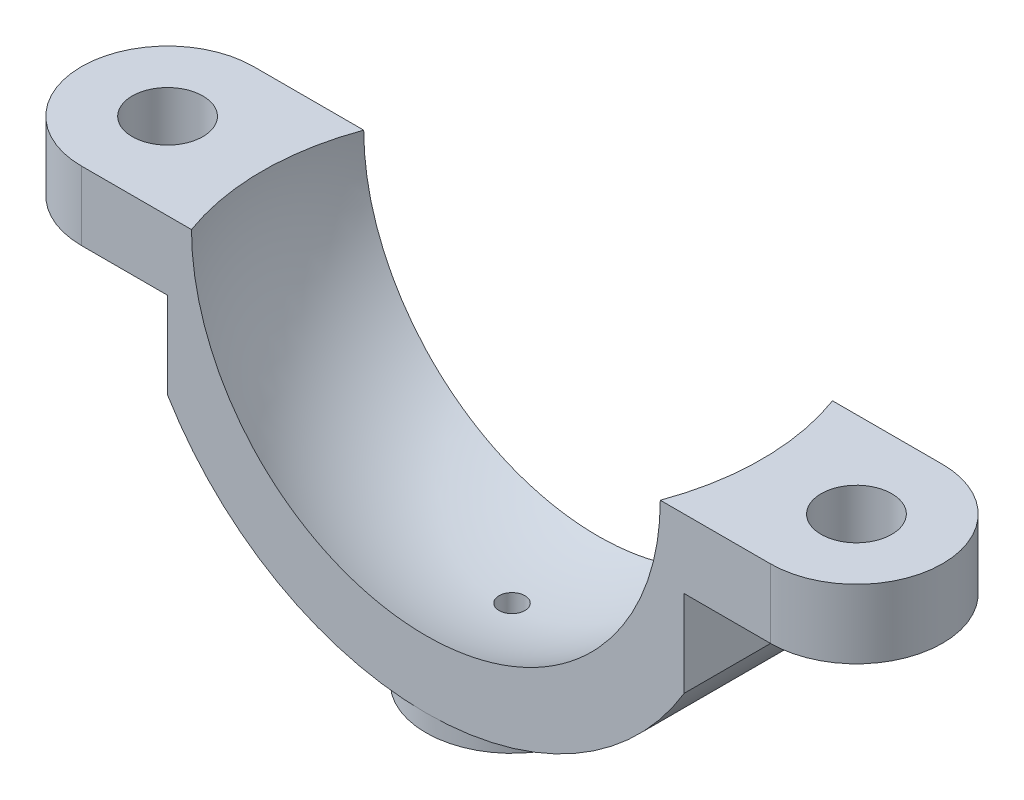
from build123d import *

# Parameters (mm, degrees)
EXTRUDE_2_DEPTH      = 19
EXTRUDE_3_DEPTH      = 40
CUT_EXTRUDE_START    = -32
CUT_EXTRUDE_1_DEPTH  = 32
SKETCH_4_R           = 4.1
CUT_EXTRUDE_2_DEPTH  = 60.916608716
EXTRUDE_4_REACH      = 102.922
EXTRUDE_4_END_RADIUS = 35
EXTRUDE_START        = -37
SKETCH_5_R           = 10
SKETCH_5_R_2         = 1.5
SKETCH_5_4_R         = 1.5
CUT_EXTRUDE_3_DEPTH  = 66.038450252
CUT_EXTRUDE_4_DEPTH  = 12
SKETCH_6_R           = 4
CUT_EXTRUDE_5_DEPTH  = 30
SKETCH_10_W          = 80
SKETCH_10_H          = 68
CUT_EXTRUDE_6_DEPTH  = 76.617458351
SKETCH_11_W          = 80
SKETCH_11_H          = 20
CUT_EXTRUDE_7_DEPTH  = 69.629439801
SKETCH_12_W          = 10
SKETCH_12_H          = 20
CUT_EXTRUDE_8_DEPTH  = 59.660037571
SKETCH_13_W          = 10
SKETCH_13_H          = 20
CUT_EXTRUDE_9_DEPTH  = 59.660037571
SKETCH_14_R          = 1.5
CUT_EXTRUDE_10_DEPTH = 64.000000016


with BuildPart() as part:
    # Эскиз1 → Бобышка-Вытянуть2 (new, symmetric)
    with BuildSketch(Plane.XY):
        with BuildLine():
            Line((35, 0), (26, 0))
            ThreePointArc((26, 0), (0, -26), (-26, 0))
            Line((-26, 0), (-35, 0))
            ThreePointArc((-35, 0), (0, -35), (35, 0))
        make_face()
        with BuildLine():
            Line((26, 0), (24, 0))
            ThreePointArc((24, 0), (0, -24), (-24, 0))
            Line((-24, 0), (-26, 0))
            ThreePointArc((-26, 0), (0, -26), (26, 0))
        make_face()
    extrude(amount=EXTRUDE_2_DEPTH, both=True)

    # Эскиз2 → Бобышка-Вытянуть3 (add)
    with BuildSketch(Plane(origin=(0, 0, 0), x_dir=(1, 0, 0), z_dir=(0, 1, 0))):
        with BuildLine():
            ThreePointArc((50, 0), (47.071067812, 7.071067812), (40, 10))
            ThreePointArc((40, 10), (37.411809549, 9.659258263), (35, 8.660254038))
            Line((35, 8.660254038), (35, -8.660254038))
            ThreePointArc((35, -8.660254038), (37.411809549, -9.659258263), (40, -10))
            ThreePointArc((40, -10), (47.071067812, -7.071067812), (50, 0))
        make_face()
        with BuildLine():
            Line((35, -8.660254038), (35, 8.660254038))
            ThreePointArc((35, 8.660254038), (31.339745962, 5), (30, 0))
            ThreePointArc((30, 0), (31.339745962, -5), (35, -8.660254038))
        make_face()
        with BuildLine():
            ThreePointArc((35, 8.660254038), (37.411809549, 9.659258263), (40, 10))
            Line((40, 10), (35, 10))
            Line((35, 10), (35, 8.660254038))
        make_face()
        with BuildLine():
            Line((35, -10), (40, -10))
            ThreePointArc((40, -10), (37.411809549, -9.659258263), (35, -8.660254038))
            Line((35, -8.660254038), (35, -10))
        make_face()
        with BuildLine():
            Line((35, 8.660254038), (35, 10))
            Line((35, 10), (30, 10))
            Line((30, 10), (30, 0))
            ThreePointArc((30, 0), (31.339745962, 5), (35, 8.660254038))
        make_face()
        with BuildLine():
            ThreePointArc((35, -8.660254038), (31.339745962, -5), (30, 0))
            Line((30, 0), (30, -10))
            Line((30, -10), (35, -10))
            Line((35, -10), (35, -8.660254038))
        make_face()
    extrude_3 = extrude(amount=-EXTRUDE_3_DEPTH)

    # Эскиз3 → Вырез-Вытянуть1 (cut)
    with BuildSketch(Plane.XZ.offset(40).offset(CUT_EXTRUDE_START)):
        with BuildLine():
            Line((40, 10), (30, 10))
            Line((30, 10), (30, -10))
            Line((30, -10), (40, -10))
            ThreePointArc((40, -10), (50, 0), (40, 10))
        make_face()
    cut_extrude_1 = extrude(amount=CUT_EXTRUDE_1_DEPTH, mode=Mode.SUBTRACT)

    # Эскиз4 → Вырез-Вытянуть2 (cut, through all)
    with BuildSketch(Plane.XZ.offset(8)):
        with Locations(Location((40, 0, 0), (0, 0, 270))):
            Circle(SKETCH_4_R)
    cut_extrude_2 = extrude(amount=-CUT_EXTRUDE_2_DEPTH, mode=Mode.SUBTRACT)

    # Зеркальное отражение1: Бобышка-Вытянуть3, Вырез-Вытянуть1, Вырез-Вытянуть2 across plane
    add(extrude_3.mirror(Plane(origin=(0, 0, 0), x_dir=(0, 0, 1), z_dir=(1, 0, 0))))
    add(cut_extrude_1.mirror(Plane(origin=(0, 0, 0), x_dir=(0, 0, 1), z_dir=(1, 0, 0))), mode=Mode.SUBTRACT)
    add(cut_extrude_2.mirror(Plane(origin=(0, 0, 0), x_dir=(0, 0, 1), z_dir=(1, 0, 0))), mode=Mode.SUBTRACT)

    # Бобышка-Вытянуть4: up to this cylinder (the profile starts outside it)
    extrude_4_end = Plane(origin=(0, 0, 4.8585785), z_dir=(0, 0, -1)) * Cylinder(EXTRUDE_4_END_RADIUS, 286.561157, mode=Mode.PRIVATE)
    # Эскиз5 → Бобышка-Вытянуть4 (add, up to the surface)
    with BuildSketch(Plane(origin=(0, 0, 0), x_dir=(1, 0, 0), z_dir=(0, 1, 0)).offset(EXTRUDE_START), mode=Mode.PRIVATE) as extrude_4_sk1:
        with Locations(Location((0, 0, 0), (0, 0, 90))):
            Circle(SKETCH_5_R)
        Circle(SKETCH_5_R_2, mode=Mode.SUBTRACT)
    extrude_4_tool1 = extrude(extrude_4_sk1.sketch, amount=EXTRUDE_4_REACH, mode=Mode.PRIVATE) - extrude_4_end
    add(extrude_4_tool1.solids().sort_by_distance((0, -37, 9.717157))[0])
    # Эскиз5 → Бобышка-Вытянуть4 (add, up to the surface)
    with BuildSketch(Plane(origin=(0, 0, 0), x_dir=(1, 0, 0), z_dir=(0, 1, 0)).offset(EXTRUDE_START), mode=Mode.PRIVATE) as extrude_4_sk2:
        Circle(SKETCH_5_R_2)
    extrude_4_tool2 = extrude(extrude_4_sk2.sketch, amount=EXTRUDE_4_REACH, mode=Mode.PRIVATE) - extrude_4_end
    add(extrude_4_tool2.solids().sort_by_distance((0, -37, 0))[0])

    # Эскиз5<4> → Вырез-Вытянуть3 (cut, through all)
    with BuildSketch(Plane(origin=(0, 0, 0), x_dir=(1, 0, 0), z_dir=(0, 1, 0))):
        with Locations(Location((0, 0, 0), (0, 0, 270))):
            Circle(SKETCH_5_4_R)
    extrude(amount=-CUT_EXTRUDE_3_DEPTH, mode=Mode.SUBTRACT)

    # Эскиз1<4> → Вырез-Вытянуть4 (cut, symmetric)
    with BuildSketch(Plane.XY):
        with BuildLine():
            ThreePointArc((-24, 0), (0, 24), (24, 0))
            Line((24, 0), (26, 0))
            ThreePointArc((26, 0), (0, 26), (-26, 0))
            Line((-26, 0), (-24, 0))
        make_face()
        with BuildLine():
            Line((26, 0), (24, 0))
            ThreePointArc((24, 0), (0, -24), (-24, 0))
            Line((-24, 0), (-26, 0))
            ThreePointArc((-26, 0), (0, -26), (26, 0))
        make_face()
    extrude(amount=CUT_EXTRUDE_4_DEPTH, both=True, mode=Mode.SUBTRACT)

    # Эскиз6 → Вырез-Вытянуть5 (cut)
    with BuildSketch(Plane(origin=(0, 0, 0), x_dir=(1, 0, 0), z_dir=(0, 1, 0))):
        with Locations(Location((0, 0, 0), (0, 0, 270))):
            Circle(SKETCH_6_R)
    extrude(amount=-CUT_EXTRUDE_5_DEPTH, mode=Mode.SUBTRACT)

    # Эскиз7 → Повернуть1 (revolve)
    with BuildSketch(Plane.XY):
        with BuildLine():
            Line((0, 33), (0, -33))
            ThreePointArc((0, -33), (33, 0), (0, 33))
        make_face()
    revolve(axis=Axis((0, 0, 0), (0, 1, 0)))

    # Эскиз8 → Вырез-Повернуть1 (revolve, cut)
    with BuildSketch(Plane.XY):
        with BuildLine():
            Line((0, 29), (0, -29))
            ThreePointArc((0, -29), (29, 0), (0, 29))
        make_face()
    revolve(axis=Axis((0, 0, 0), (0, 1, 0)), mode=Mode.SUBTRACT)

    # Эскиз10 → Вырез-Вытянуть6 (cut, through all)
    with BuildSketch(Plane(origin=(0, 0, -10), x_dir=(-1, 0, 0), z_dir=(0, 0, -1))):
        with Locations((0, -1)):
            Rectangle(SKETCH_10_W, SKETCH_10_H)
    cut_extrude_6 = extrude(amount=CUT_EXTRUDE_6_DEPTH, mode=Mode.SUBTRACT)

    # Зеркальное отражение2: Вырез-Вытянуть6 across plane
    add(cut_extrude_6.mirror(Plane.XY), mode=Mode.SUBTRACT)

    # Эскиз11 → Вырез-Вытянуть7 (cut, through all)
    with BuildSketch(Plane(origin=(0, 0, 0), x_dir=(1, 0, 0), z_dir=(0, 1, 0))):
        Rectangle(SKETCH_11_W, SKETCH_11_H)
    extrude(amount=CUT_EXTRUDE_7_DEPTH, mode=Mode.SUBTRACT)

    # Эскиз12 → Вырез-Вытянуть8 (cut, through all)
    with BuildSketch(Plane.XZ.offset(8)):
        with Locations((-35, 0)):
            Rectangle(SKETCH_12_W, SKETCH_12_H)
    extrude(amount=CUT_EXTRUDE_8_DEPTH, mode=Mode.SUBTRACT)

    # Эскиз13 → Вырез-Вытянуть9 (cut, through all)
    with BuildSketch(Plane.XZ.offset(8)):
        with Locations((35, 0)):
            Rectangle(SKETCH_13_W, SKETCH_13_H)
    extrude(amount=CUT_EXTRUDE_9_DEPTH, mode=Mode.SUBTRACT)

    # Эскиз14 → Вырез-Вытянуть10 (cut, through all)
    with BuildSketch(Plane.XZ.offset(37)):
        with Locations(Location((0, 0, 0), (0, 0, 90))):
            Circle(SKETCH_14_R)
    extrude(amount=-CUT_EXTRUDE_10_DEPTH, mode=Mode.SUBTRACT)


solid = part.part
